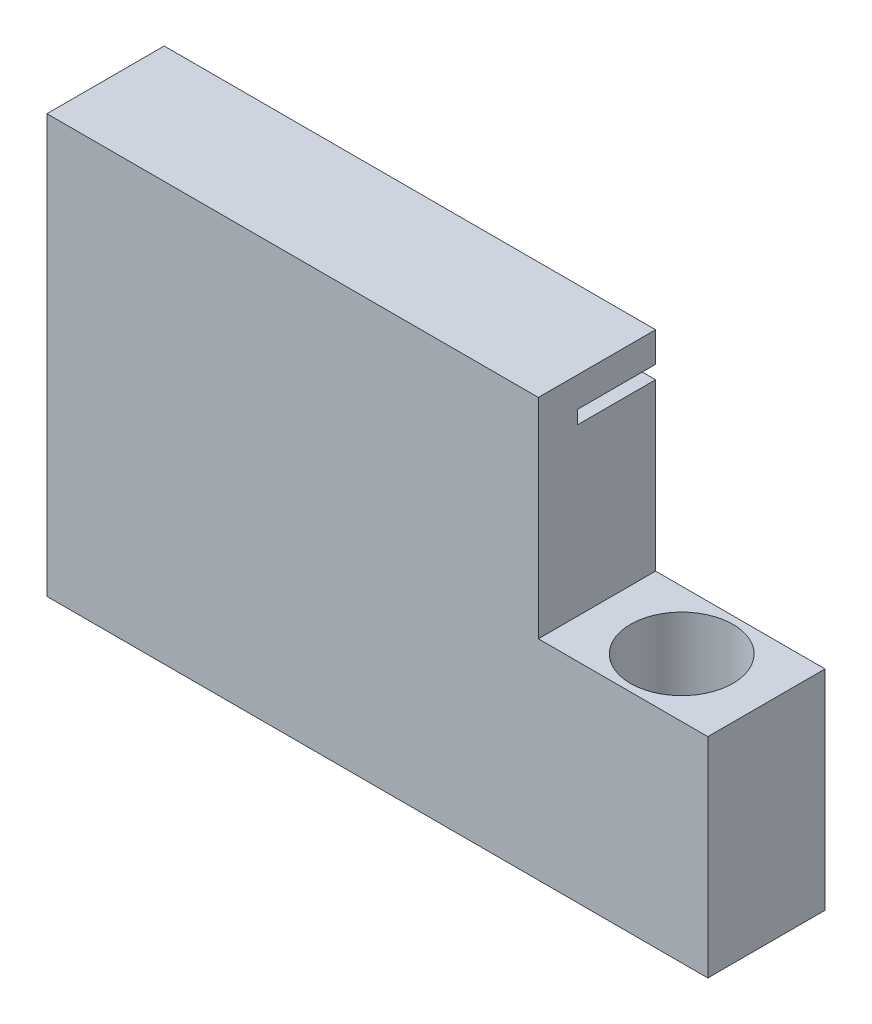
from build123d import *

# Parameters (mm, degrees)
SKETCH_1_W          = 125.74675372
SKETCH_1_H          = 106.976622422
EXTRUDE_3_DEPTH     = 30
SKETCH_3_W          = 40.480715441
SKETCH_3_H          = 75.445810288
CUT_EXTRUDE_2_DEPTH = 20
SKETCH_6_W          = 4.561176424
SKETCH_6_H          = 3.413136976
SKETCH_6_W_2        = 27.210286446
SKETCH_6_H_2        = 12.79926366
SKETCH_6_W_3        = 17.507485433
SKETCH_6_H_3        = 32.993657433
CUT_EXTRUDE_6_DEPTH = 20
CUT_EXTRUDE_7_DEPTH = 10
SKETCH_8_W          = 43.362055896
SKETCH_8_H          = 5.90330429
EXTRUDE_4_DEPTH     = 30
SKETCH_9_W          = 43.362055896
SKETCH_9_H          = 30
SKETCH_9_R          = 13.106917469
EXTRUDE_5_DEPTH     = 50


with BuildPart() as part:
    # 草图1 → 凸台-拉伸3 (new body)
    with BuildSketch(Plane.XY):
        Rectangle(SKETCH_1_W, SKETCH_1_H)
    extrude(amount=EXTRUDE_3_DEPTH)

    # 草图3 → 切除-拉伸2 (cut)
    with BuildSketch(Plane.XY):
        with Locations((-0.814646552, -3.347576181)):
            Rectangle(SKETCH_3_W, SKETCH_3_H)
    extrude(amount=CUT_EXTRUDE_2_DEPTH, mode=Mode.SUBTRACT)

    # 草图6 → 切除-拉伸6 (cut)
    with BuildSketch(Plane.XY):
        with Locations((60.592788648, 44.118378059)):
            Rectangle(SKETCH_6_W, SKETCH_6_H)
        with Locations((44.707057213, 43.502117216)):
            Rectangle(SKETCH_6_W_2, SKETCH_6_H_2)
        with Locations((-48.375754904, 33.501377131)):
            Rectangle(SKETCH_6_W_3, SKETCH_6_H_3)
    extrude(amount=CUT_EXTRUDE_6_DEPTH, mode=Mode.SUBTRACT)

    # 草图7 → 切除-拉伸7 (cut)
    with BuildSketch(Plane.XY):
        with BuildLine():
            Line((31.10191399, 49.901749046), (19.425711168, 49.901749046))
            Line((19.425711168, 49.901749046), (18.685275266, 49.901749046))
            ThreePointArc((18.685275266, 49.901749046), (17.978168485, 49.608855827), (17.685275266, 48.901749046))
            Line((17.685275266, 48.901749046), (17.685275266, 34.375328963))
            Line((17.685275266, 34.375328963), (19.425711168, 34.375328963))
            Line((19.425711168, 34.375328963), (19.425711168, 46.90603785))
            ThreePointArc((19.425711168, 46.90603785), (19.718604387, 47.613144632), (20.425711168, 47.90603785))
            Line((20.425711168, 47.90603785), (31.10191399, 47.90603785))
            Line((31.10191399, 47.90603785), (31.10191399, 49.901749046))
        make_face()
        with BuildLine():
            Line((-39.622012187, 17.004548414), (-40.809816648, 17.004548414))
            Line((-40.809816648, 17.004548414), (-40.809816648, 6.183104922))
            Line((-40.809816648, 6.183104922), (-40.809816648, 5.834646341))
            ThreePointArc((-40.809816648, 5.834646341), (-40.516923429, 5.12753956), (-39.809816648, 4.834646341))
            Line((-39.809816648, 4.834646341), (-21.055004273, 4.834646341))
            Line((-21.055004273, 4.834646341), (-21.055004273, 6.183104922))
            Line((-21.055004273, 6.183104922), (-38.622012187, 6.183104922))
            ThreePointArc((-38.622012187, 6.183104922), (-39.329118968, 6.475998141), (-39.622012187, 7.183104922))
            Line((-39.622012187, 7.183104922), (-39.622012187, 17.004548414))
        make_face()
    extrude(amount=CUT_EXTRUDE_7_DEPTH, mode=Mode.SUBTRACT)

    # 草图8 → 凸台-拉伸4 (add)
    with BuildSketch(Plane.XY):
        with Locations((84.554404808, -50.536659066)):
            Rectangle(SKETCH_8_W, SKETCH_8_H)
    extrude(amount=EXTRUDE_4_DEPTH)

    # 草图9 → 凸台-拉伸5 (add)
    with BuildSketch(Plane(origin=(0, 0, 0), x_dir=(1, 0, 0), z_dir=(0, 1, 0))):
        with Locations((84.554404808, -15)):
            Rectangle(SKETCH_9_W, SKETCH_9_H)
        with Locations(Location((84.554404808, -15, 0), (0, 0, 270))):
            Circle(SKETCH_9_R, mode=Mode.SUBTRACT)
    extrude(amount=-EXTRUDE_5_DEPTH)


solid = part.part
